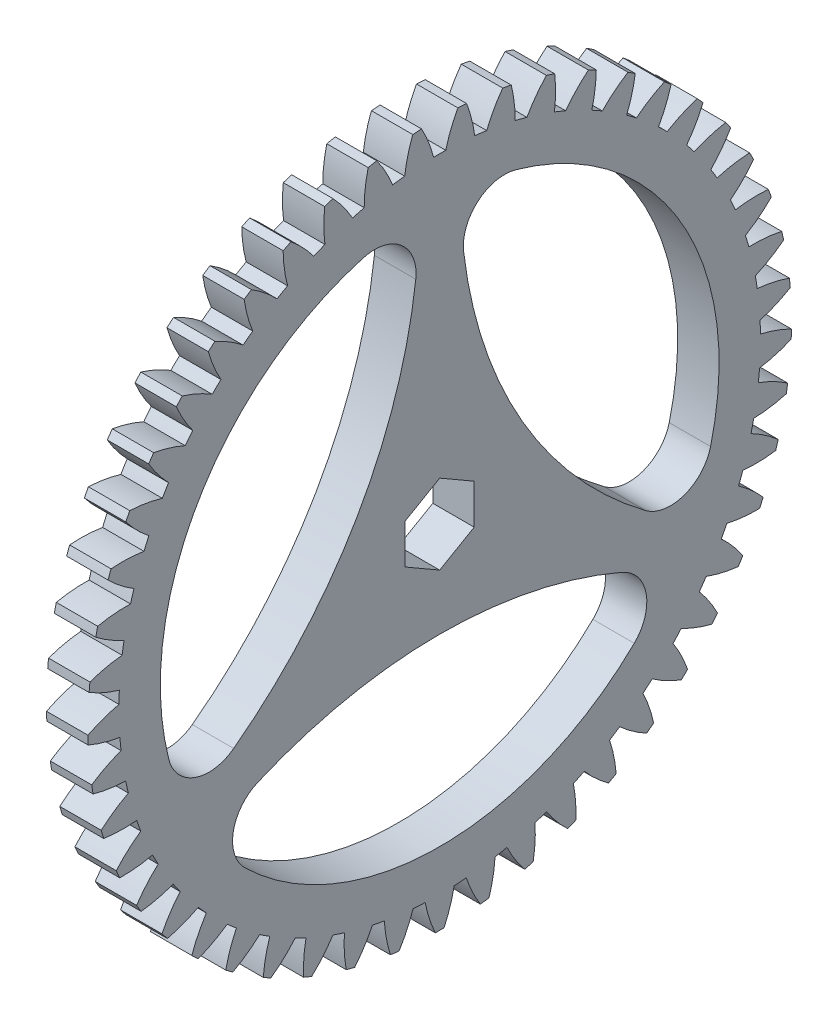
from build123d import *

# Parameters (mm, degrees)
BASPROSKE_W        = 3
BASPROSKE_H        = 25.5
TOOTHCUT_DEPTH     = 37.187014245
TEETHCUTS_COUNT    = 49
TEETHCUTS_ANGLE    = 352.653061224
BORSKE_R           = 1.5
BORE_DEPTH         = 50.0000508
CUT_EXTRUDE1_DEPTH = 10
FILLET1_R          = 3


with BuildPart() as part:
    # BasProSke → Base-Revolve (revolve)
    with BuildSketch(Plane(origin=(0, 0, 0), x_dir=(1, 0, 0), z_dir=(0, 1, 0)), mode=Mode.PRIVATE) as base_revolve_sk:
        with Locations((1.5, 12.75)):
            Rectangle(BASPROSKE_W, BASPROSKE_H)
    revolve(base_revolve_sk.sketch.rotate(Axis((-10, 0, 0), (1, 0, 0)), 180), axis=Axis((-10, 0, 0), (1, 0, 0)))

    # TooCutSke → ToothCut (cut, through all)
    with BuildSketch(Plane(origin=(0, 0, 0), x_dir=(0, 0, -1), z_dir=(1, 0, 0))):
        with BuildLine():
            ThreePointArc((0.438573496, 23.244862966), (0, 23.249), (-0.438573496, 23.244862966))
            ThreePointArc((-0.438573496, 23.244862966), (-0.815537702, 24.39538671), (-1.331491021, 25.490648811))
            ThreePointArc((-1.331491021, 25.490648811), (0, 25.5254), (1.331491021, 25.490648811))
            ThreePointArc((1.331491021, 25.490648811), (0.815537702, 24.39538671), (0.438573496, 23.244862966))
        make_face()
    toothcut = extrude(amount=TOOTHCUT_DEPTH, mode=Mode.SUBTRACT)

    # TeethCuts: ToothCut ×49 about axis
    teethcuts_axis = Axis((-10, 0, 0), (1, 0, 0))
    for i in range(1, TEETHCUTS_COUNT):
        add(toothcut.rotate(teethcuts_axis, i * TEETHCUTS_ANGLE / (TEETHCUTS_COUNT - 1)), mode=Mode.SUBTRACT)

    # BorSke → Bore (cut, symmetric)
    with BuildSketch(Plane(origin=(0, 0, 0), x_dir=(0, 0, -1), z_dir=(1, 0, 0))):
        with Locations(Location((0, 0, 0), (0, 0, 180))):
            Circle(BORSKE_R)
    extrude(amount=BORE_DEPTH, both=True, mode=Mode.SUBTRACT)

    # Sketch1 → Cut-Extrude1 (cut)
    with BuildSketch(Plane.ZY):
        with BuildLine():
            ThreePointArc((18.237967313, -8.79764453), (19.739840439, -4.512283284), (20.249, 0))
            ThreePointArc((20.249, 0), (14.839061645, 13.777672173), (1.5, 20.193365272))
            ThreePointArc((1.5, 20.193365272), (5.984924825, 3.455397959), (18.237967313, -8.79764453))
        make_face()
        with BuildLine():
            ThreePointArc((-18.237967313, -8.79764453), (-5.984924825, 3.455397959), (-1.5, 20.193365272))
            ThreePointArc((-1.5, 20.193365272), (-17.536148401, 10.1245), (-18.237967313, -8.79764453))
        make_face()
        with BuildLine():
            ThreePointArc((-16.737967313, -11.395720742), (0, -20.249), (16.737967313, -11.395720742))
            ThreePointArc((16.737967313, -11.395720742), (0, -6.910795917), (-16.737967313, -11.395720742))
        make_face()
        Polygon((-2.5, 1.443375673), (-2.5, -1.443375673), (0, -2.886751346), (2.5, -1.443375673), (2.5, 1.443375673), (0, 2.886751346), align=None)
    extrude(amount=-CUT_EXTRUDE1_DEPTH, mode=Mode.SUBTRACT)

    # Fillet1
    fillet1_edges = [part.edges().sort_by_distance(p)[0] for p in [
        (1.5, 20.193365272, 1.5),
        (1.5, -8.79764453, 18.237967313),
        (1.5, 20.193365272, -1.5),
        (1.5, -8.79764453, -18.237967313),
        (1.5, -11.395720742, 16.737967313),
        (1.5, -11.395720742, -16.737967313),
    ]]
    fillet(fillet1_edges, radius=FILLET1_R)


solid = part.part
